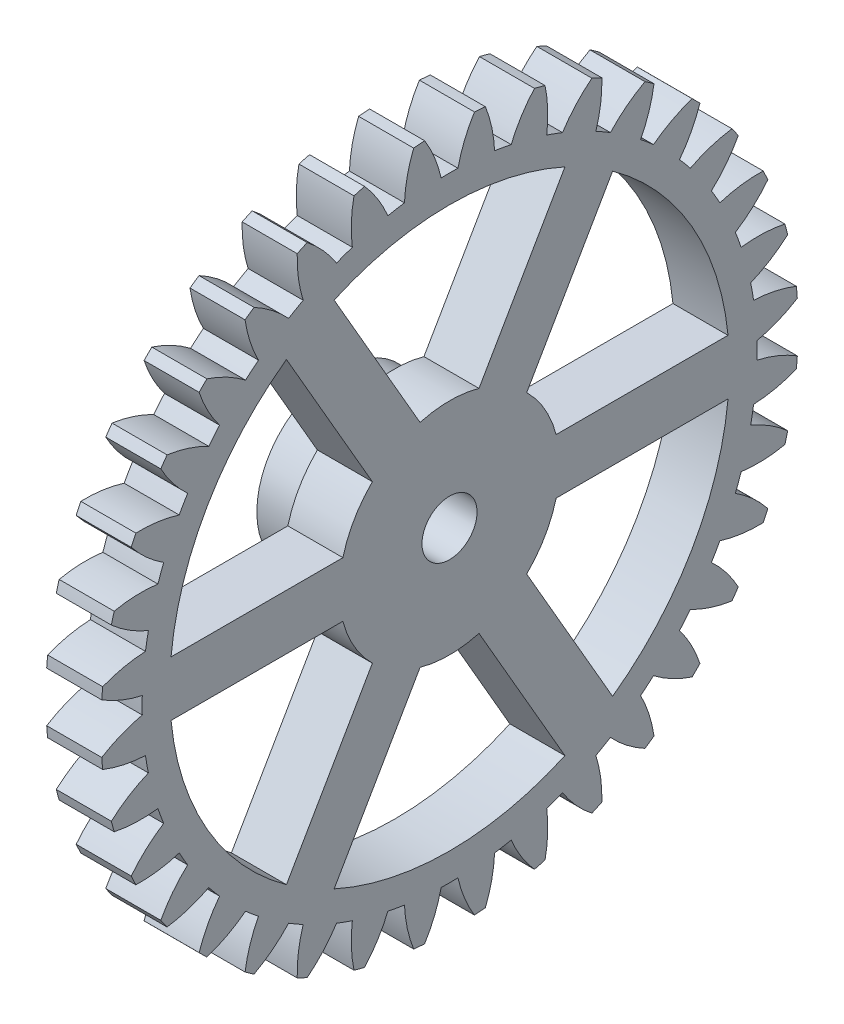
from build123d import *

# Parameters (mm, degrees)
BASPROSKE_W        = 6.35
BASPROSKE_H        = 40.216666667
TOOTHCUT_DEPTH     = 58.228341366
TEETHCUTS_COUNT    = 36
TEETHCUTS_ANGLE    = 350
HUBNEAONESKE_R     = 9.525
HUBNEARONE_DEPTH   = 6.3500508
BORSKE_R           = 3.175
BORE_DEPTH         = 12.7000508
CUT_EXTRUDE1_DEPTH = 58.083773435
CIRPATTERN1_COUNT  = 6


with BuildPart() as part:
    # BasProSke → Base-Revolve (revolve)
    with BuildSketch(Plane(origin=(0, 0, 0), x_dir=(1, 0, 0), z_dir=(0, 1, 0)), mode=Mode.PRIVATE) as base_revolve_sk:
        with Locations((3.175, 20.108333334)):
            Rectangle(BASPROSKE_W, BASPROSKE_H)
    revolve(base_revolve_sk.sketch.rotate(Axis((-10, 0, 0), (1, 0, 0)), 180), axis=Axis((-10, 0, 0), (1, 0, 0)))

    # TooCutSke → ToothCut (cut, through all)
    with BuildSketch(Plane(origin=(0, 0, 0), x_dir=(0, 0, -1), z_dir=(1, 0, 0))):
        with BuildLine():
            ThreePointArc((0.970562298, 35.439609068), (0, 35.452896667), (-0.970562298, 35.439609068))
            ThreePointArc((-0.970562298, 35.439609068), (-1.733147448, 37.869347941), (-2.889675051, 40.138182666))
            ThreePointArc((-2.889675051, 40.138182666), (0, 40.242066667), (2.889675051, 40.138182666))
            ThreePointArc((2.889675051, 40.138182666), (1.733147448, 37.869347941), (0.970562298, 35.439609068))
        make_face()
    toothcut = extrude(amount=TOOTHCUT_DEPTH, mode=Mode.SUBTRACT)

    # TeethCuts: ToothCut ×36 about axis
    teethcuts_axis = Axis((-10, 0, 0), (1, 0, 0))
    for i in range(1, TEETHCUTS_COUNT):
        add(toothcut.rotate(teethcuts_axis, i * TEETHCUTS_ANGLE / (TEETHCUTS_COUNT - 1)), mode=Mode.SUBTRACT)

    # HubNeaOneSke → HubNearOne (add)
    with BuildSketch(Plane.ZY):
        with Locations(Location((0, 0, 0), (0, 0, 180))):
            Circle(HUBNEAONESKE_R)
    extrude(amount=HUBNEARONE_DEPTH)

    # BorSke → Bore (cut, symmetric)
    with BuildSketch(Plane(origin=(0, 0, 0), x_dir=(0, 0, -1), z_dir=(1, 0, 0))):
        with Locations(Location((0, 0, 0), (0, 0, 180))):
            Circle(BORSKE_R)
    extrude(amount=BORE_DEPTH, both=True, mode=Mode.SUBTRACT)

    # Sketch1 → Cut-Extrude1 (cut, through all)
    with BuildSketch(Plane.ZY):
        with BuildLine():
            Line((-8.897991719, 9.061773743), (-18.810312369, 26.230416729))
            ThreePointArc((-18.810312369, 26.230416729), (-27.953478494, 16.138948333), (-32.121363424, 3.175))
            Line((-32.121363424, 3.175), (-12.296722124, 3.175))
            ThreePointArc((-12.296722124, 3.175), (-10.998522628, 6.35), (-8.897991719, 9.061773743))
        make_face()
    cut_extrude1 = extrude(amount=-CUT_EXTRUDE1_DEPTH, mode=Mode.SUBTRACT)

    # CirPattern1: Cut-Extrude1 ×6 about axis
    cirpattern1_axis = Axis((0, 0, 0), (1, 0, 0))
    for i in range(1, CIRPATTERN1_COUNT):
        add(cut_extrude1.rotate(cirpattern1_axis, i * 360 / CIRPATTERN1_COUNT), mode=Mode.SUBTRACT)


solid = part.part
